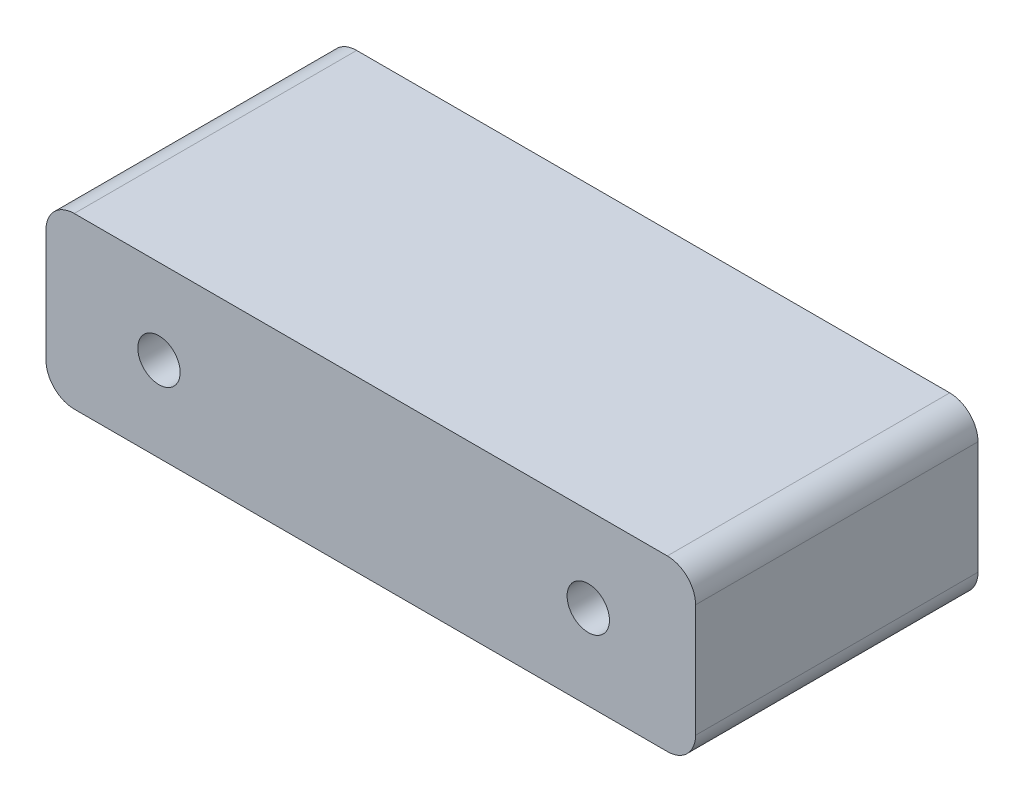
from build123d import *

# Parameters (mm, degrees)
CROQUIS1_W              = 23
CROQUIS1_H              = 6
CROQUIS1_R              = 0.75
SALIENTE_EXTRUIR1_DEPTH = 10
REDONDEO1_R             = 1


with BuildPart() as part:
    # Croquis1 → Saliente-Extruir1 (new body)
    with BuildSketch(Plane.XY):
        with Locations((5.149192547, 0.311552795)):
            Rectangle(CROQUIS1_W, CROQUIS1_H)
        with Locations((-2.350807453, 0.311552795)):
            Circle(CROQUIS1_R, mode=Mode.SUBTRACT)
        with Locations((12.849192547, 0.311552795)):
            Circle(CROQUIS1_R, mode=Mode.SUBTRACT)
    extrude(amount=SALIENTE_EXTRUIR1_DEPTH)

    # Redondeo1
    redondeo1_edges = [part.edges().sort_by_distance(p)[0] for p in [
        (16.649192547, -2.688447205, 5),
        (-6.350807453, -2.688447205, 5),
        (-6.350807453, 3.311552795, 5),
        (16.649192547, 3.311552795, 5),
    ]]
    fillet(redondeo1_edges, radius=REDONDEO1_R)


solid = part.part
